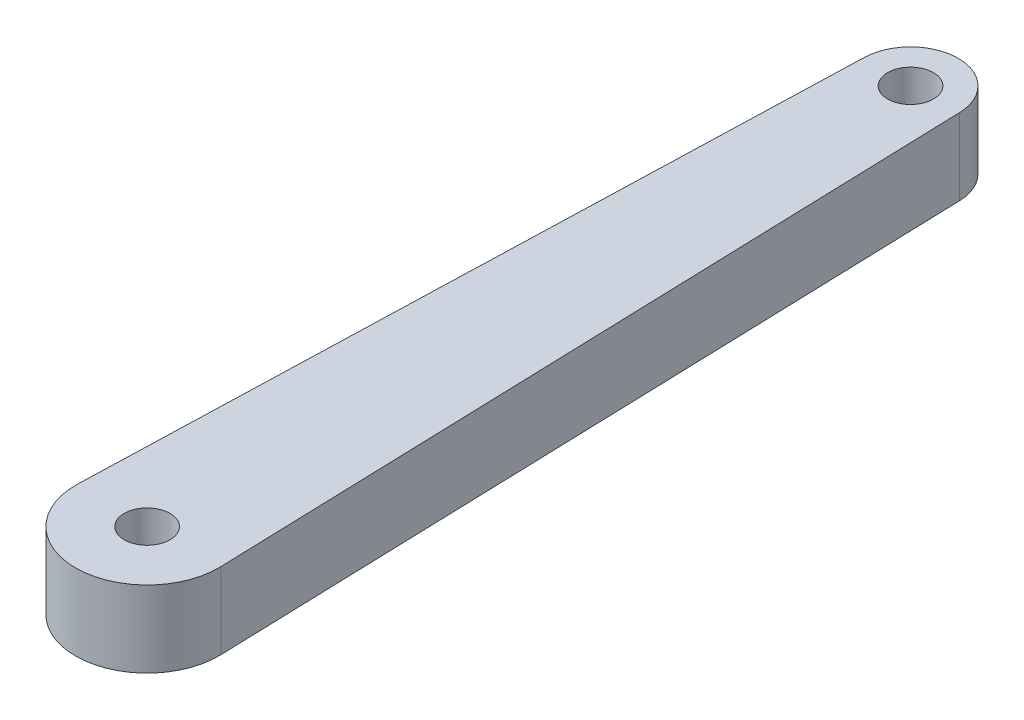
from build123d import *

# Parameters (mm, degrees)
SKETCH1_R           = 1.2
BOSS_EXTRUDE1_DEPTH = 4


with BuildPart() as part:
    # Sketch1 → Boss-Extrude1 (new body)
    with BuildSketch(Plane(origin=(0, 0, 0), x_dir=(1, 0, 0), z_dir=(0, 1, 0))):
        with BuildLine():
            ThreePointArc((-3.748168498, 0.1171875), (0, -3.75), (3.748168498, 0.1171875))
            Line((3.748168498, 0.1171875), (2.498778999, 40.078125))
            ThreePointArc((2.498778999, 40.078125), (0, 42.5), (-2.498778999, 40.078125))
            Line((-2.498778999, 40.078125), (-3.748168498, 0.1171875))
        make_face()
        with Locations(Location((0, 0, 0), (0, 0, 270))):
            Circle(SKETCH1_R, mode=Mode.SUBTRACT)
        with Locations(Location((0, 40, 0), (0, 0, 270))):
            Circle(SKETCH1_R, mode=Mode.SUBTRACT)
    extrude(amount=BOSS_EXTRUDE1_DEPTH)


solid = part.part
